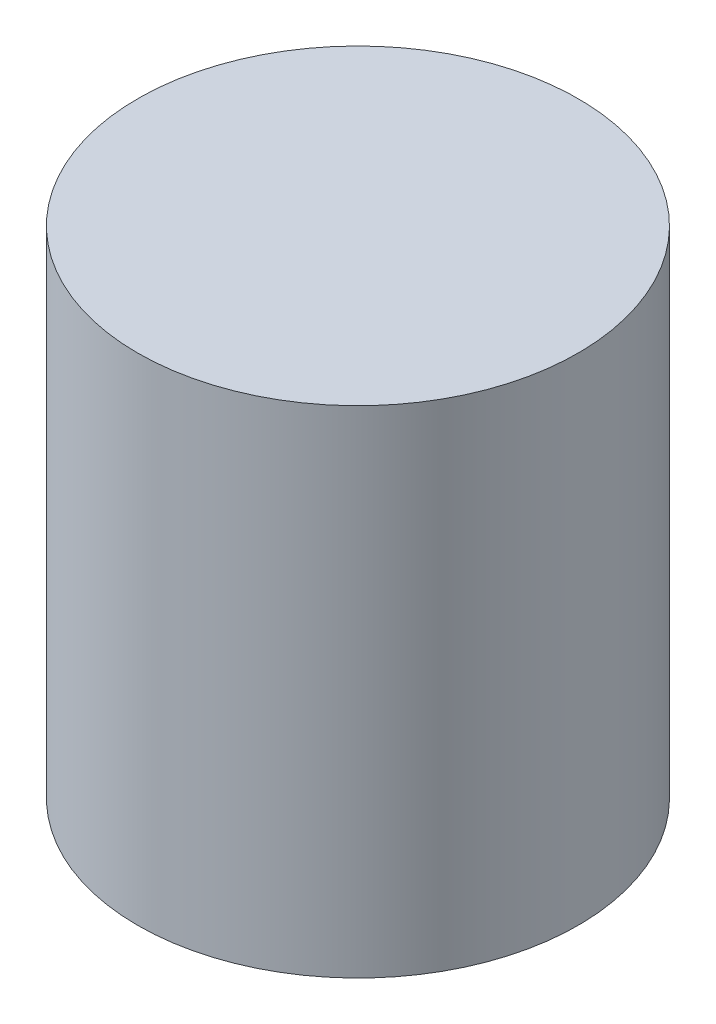
from build123d import *

# Parameters (mm, degrees)
SKETCH1_R           = 4
BOSS_EXTRUDE1_DEPTH = 9


with BuildPart() as part:
    # Sketch1 → Boss-Extrude1 (new body)
    with BuildSketch(Plane(origin=(0, 0, 0), x_dir=(1, 0, 0), z_dir=(0, 1, 0))):
        with Locations(Location((0, 0, 0), (0, 0, 270))):
            Circle(SKETCH1_R)
    extrude(amount=BOSS_EXTRUDE1_DEPTH)


solid = part.part
